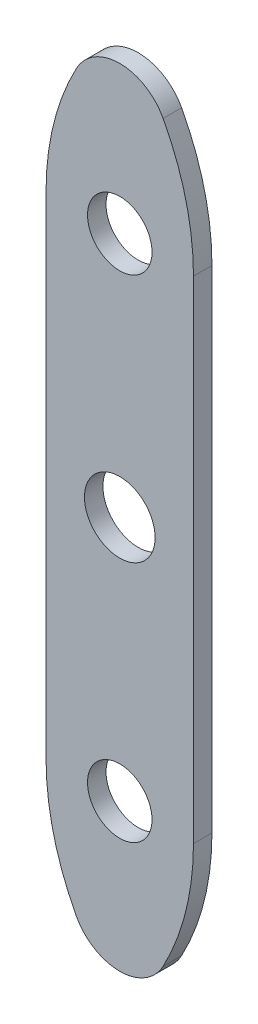
from build123d import *

# Parameters (mm, degrees)
SKETCH1_R          = 9.128125
SKETCH1_R_2        = 8.334375
BASE_EXTRUDE_DEPTH = 4.7752


with BuildPart() as part:
    # Sketch1 → Base-Extrude (new body)
    with BuildSketch(Plane.XY):
        with BuildLine():
            Line((19.05, 63.5), (19.05, -63.5))
            ThreePointArc((19.05, -63.5), (17.059251197, -79.671062799), (11.205882353, -94.876470588))
            ThreePointArc((11.205882353, -94.876470588), (0, -101.6), (-11.205882353, -94.876470588))
            ThreePointArc((-11.205882353, -94.876470588), (-17.059251197, -79.671062799), (-19.05, -63.5))
            Line((-19.05, -63.5), (-19.05, 63.5))
            ThreePointArc((-19.05, 63.5), (-17.059251197, 79.671062799), (-11.205882353, 94.876470588))
            ThreePointArc((-11.205882353, 94.876470588), (0, 101.6), (11.205882353, 94.876470588))
            ThreePointArc((11.205882353, 94.876470588), (17.059251197, 79.671062799), (19.05, 63.5))
        make_face()
        Circle(SKETCH1_R, mode=Mode.SUBTRACT)
        with Locations((0, -63.5)):
            Circle(SKETCH1_R_2, mode=Mode.SUBTRACT)
        with Locations((0, 63.5)):
            Circle(SKETCH1_R_2, mode=Mode.SUBTRACT)
    extrude(amount=BASE_EXTRUDE_DEPTH)


solid = part.part
